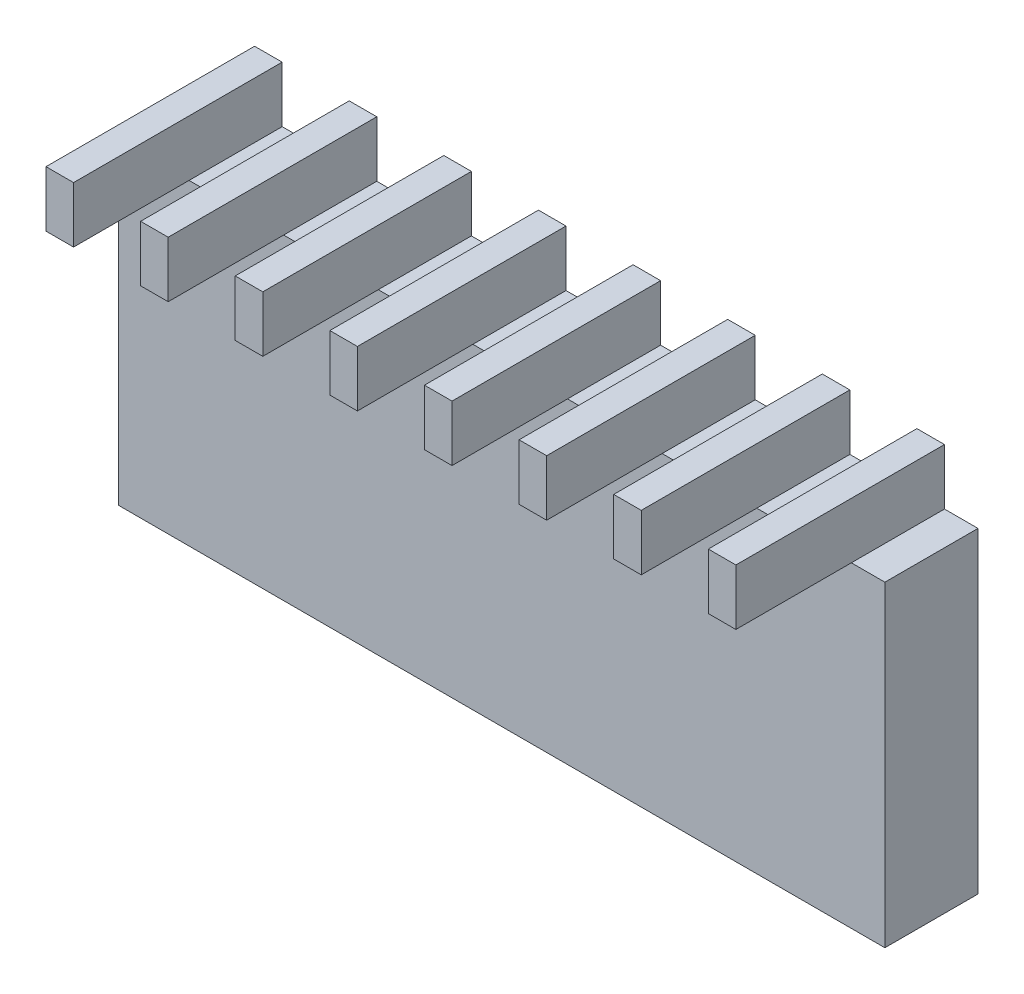
from build123d import *

# Parameters (mm, degrees)
SKETCH_1_W               = 25.9
SKETCH_1_H               = 8.5
EXTRUDE_1_DEPTH          = 2.5
SKETCH_1_5_W             = 23.6
SKETCH_1_5_H             = 1.5
EXTRUDE_2_DEPTH          = 2.5
SKETCH_2_W               = 23.6
SKETCH_2_H               = 1.5
EXTRUDE_3_DEPTH          = 3.1
SKETCH_3_W               = 1.8
SKETCH_3_H               = 5.6
CUT_EXTRUDE_1_DEPTH      = 1.5
CUT_EXTRUDE_2_DEPTH      = 2
CUT_EXTRUDE_2_DEPTH_BACK = 10
SKETCH_4_W               = 8.769979371
SKETCH_4_H               = 7.729949766


with BuildPart() as part:
    # 草图1 → 凸台-拉伸1 (new body)
    with BuildSketch(Plane.XY):
        with Locations((7.382170543, 0.04770021)):
            Rectangle(SKETCH_1_W, SKETCH_1_H)
    extrude(amount=EXTRUDE_1_DEPTH)

    # 草图1<5> → 凸台-拉伸2 (add)
    with BuildSketch(Plane.XY):
        with Locations((7.382170543, 5.04770021)):
            Rectangle(SKETCH_1_5_W, SKETCH_1_5_H)
    extrude(amount=EXTRUDE_2_DEPTH)

    # 草图2 → 凸台-拉伸3 (add)
    with BuildSketch(Plane.XY.offset(2.5)):
        with Locations((7.382170543, 5.04770021)):
            Rectangle(SKETCH_2_W, SKETCH_2_H)
    extrude(amount=EXTRUDE_3_DEPTH)

    # 草图3 → 切除-拉伸1 (cut)
    with BuildSketch(Plane(origin=(0, 5.79770021, 0), x_dir=(1, 0, 0), z_dir=(0, 1, 0))):
        with Locations((17.542170543, -2.8)):
            Rectangle(SKETCH_3_W, SKETCH_3_H)
        with Locations((15.002170543, -2.8)):
            Rectangle(SKETCH_3_W, SKETCH_3_H)
        with Locations((12.462170543, -2.8)):
            Rectangle(SKETCH_3_W, SKETCH_3_H)
        with Locations((9.922170543, -2.8)):
            Rectangle(SKETCH_3_W, SKETCH_3_H)
        with Locations((7.382170543, -2.8)):
            Rectangle(SKETCH_3_W, SKETCH_3_H)
        with Locations((4.842170543, -2.8)):
            Rectangle(SKETCH_3_W, SKETCH_3_H)
        with Locations((2.302170543, -2.8)):
            Rectangle(SKETCH_3_W, SKETCH_3_H)
        with Locations((-0.237829457, -2.8)):
            Rectangle(SKETCH_3_W, SKETCH_3_H)
        with Locations((-2.777829457, -2.8)):
            Rectangle(SKETCH_3_W, SKETCH_3_H)
    extrude(amount=-CUT_EXTRUDE_1_DEPTH, mode=Mode.SUBTRACT)

    # 草图4 → 切除-拉伸2 (cut, two sides: drawn at the far end of the back side and taken through both)
    with BuildSketch(Plane(origin=(0, 4.29770021, 0), x_dir=(1, 0, 0), z_dir=(0, 1, 0)).offset(-CUT_EXTRUDE_2_DEPTH_BACK)):
        with Locations((19.387160229, -2.378366376)):
            Rectangle(SKETCH_4_W, SKETCH_4_H)
    extrude(amount=CUT_EXTRUDE_2_DEPTH + CUT_EXTRUDE_2_DEPTH_BACK, mode=Mode.SUBTRACT)


solid = part.part
